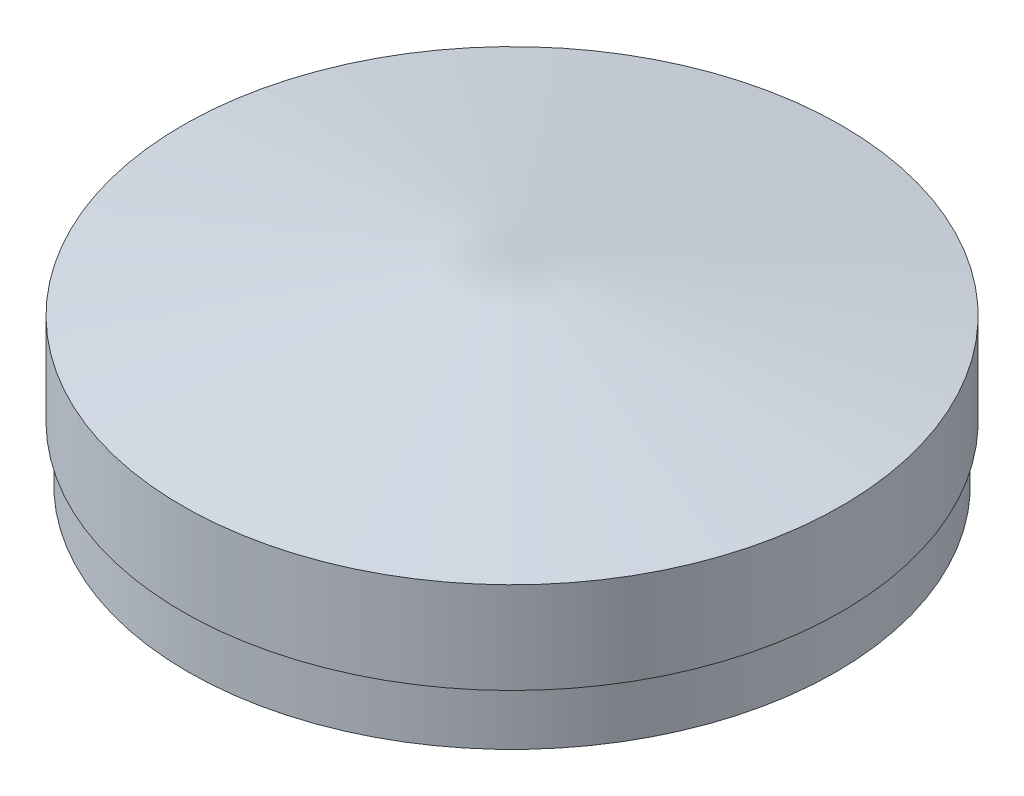
from build123d import *

# Parameters (mm, degrees)
SKETCH2_R           = 18
BOSS_EXTRUDE1_DEPTH = 5
SKETCH3_R           = 17.7
SKETCH3_R_2         = 16.7
BOSS_EXTRUDE2_DEPTH = 3
CUT_EXTRUDE1_START  = -5
SKETCH4_R           = 16.7
CUT_EXTRUDE1_DEPTH  = 5
SKETCH5_R           = 2.5
SKETCH5_R_2         = 2
BOSS_EXTRUDE3_DEPTH = 8


with BuildPart() as part:
    # Sketch1 → Revolve1 (revolve)
    with BuildSketch(Plane(origin=(0, 0, 0), x_dir=(0, 0, -1), z_dir=(1, 0, 0))):
        Polygon((0, 0), (0, 3), (18, 0), align=None)
    revolve(axis=Axis((0, 0, 0), (0, 1, 0)))

    # Sketch2 → Boss-Extrude1 (add)
    with BuildSketch(Plane.XZ):
        with Locations(Location((0, 0, 0), (0, 0, 270))):
            Circle(SKETCH2_R)
    extrude(amount=BOSS_EXTRUDE1_DEPTH)

    # Sketch3 → Boss-Extrude2 (add)
    with BuildSketch(Plane.XZ.offset(5)):
        with Locations(Location((0, 0, 0), (0, 0, 270))):
            Circle(SKETCH3_R)
        with Locations(Location((0, 0, 0), (0, 0, 270))):
            Circle(SKETCH3_R_2, mode=Mode.SUBTRACT)
    extrude(amount=BOSS_EXTRUDE2_DEPTH)

    # Sketch4 → Cut-Extrude1 (cut)
    with BuildSketch(Plane.XZ.offset(5).offset(CUT_EXTRUDE1_START)):
        with Locations(Location((0, 0, 0), (0, 0, 270))):
            Circle(SKETCH4_R)
    extrude(amount=CUT_EXTRUDE1_DEPTH, mode=Mode.SUBTRACT)

    # Sketch5 → Boss-Extrude3 (add)
    with BuildSketch(Plane.XZ):
        with Locations(Location((0, 0, 0), (0, 0, 270))):
            Circle(SKETCH5_R)
        with Locations(Location((0, 0, 0), (0, 0, 270))):
            Circle(SKETCH5_R_2, mode=Mode.SUBTRACT)
    extrude(amount=BOSS_EXTRUDE3_DEPTH)


solid = part.part
